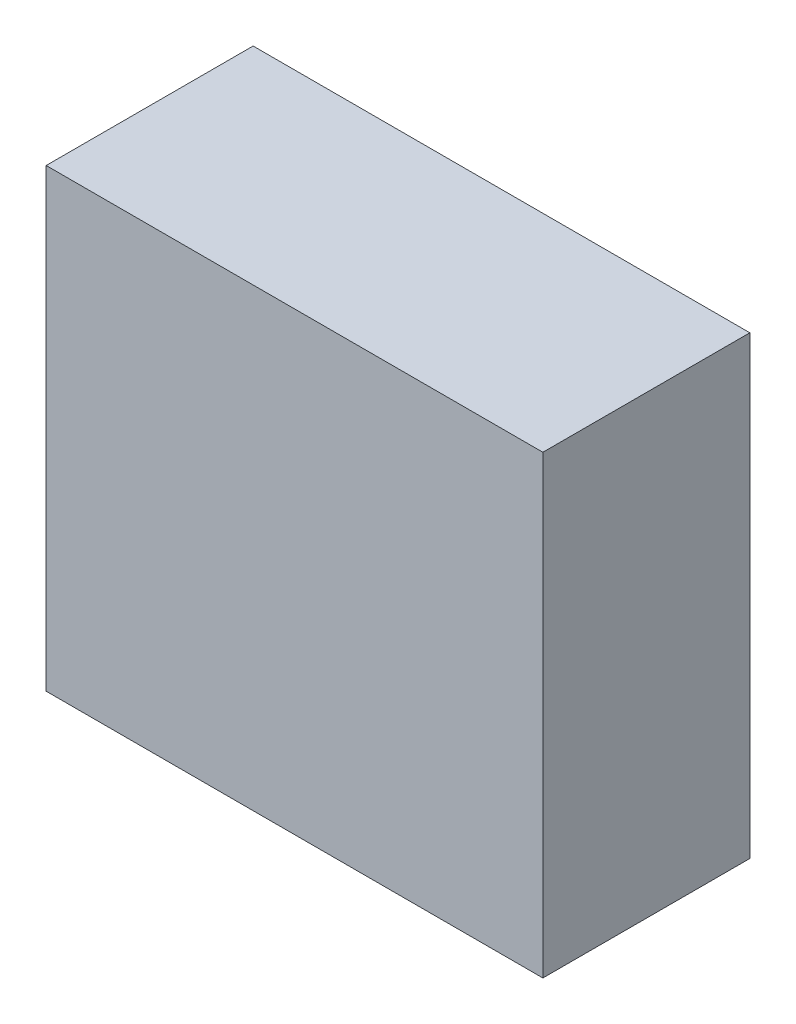
from build123d import *

# Parameters (mm, degrees)
STORE_PANO_PLC_MODBUSTCP_1_START = -650
SKETCH1_W                        = 120
SKETCH1_H                        = 110
STORE_PANO_PLC_MODBUSTCP_1_DEPTH = 50


with BuildPart() as part:
    # Sketch1 → STORE_pano_PLC_ModbusTCP_1 (new body)
    with BuildSketch(Plane.XY.offset(STORE_PANO_PLC_MODBUSTCP_1_START)):
        with Locations((910, 1745)):
            Rectangle(SKETCH1_W, SKETCH1_H)
    extrude(amount=-STORE_PANO_PLC_MODBUSTCP_1_DEPTH)


solid = part.part
